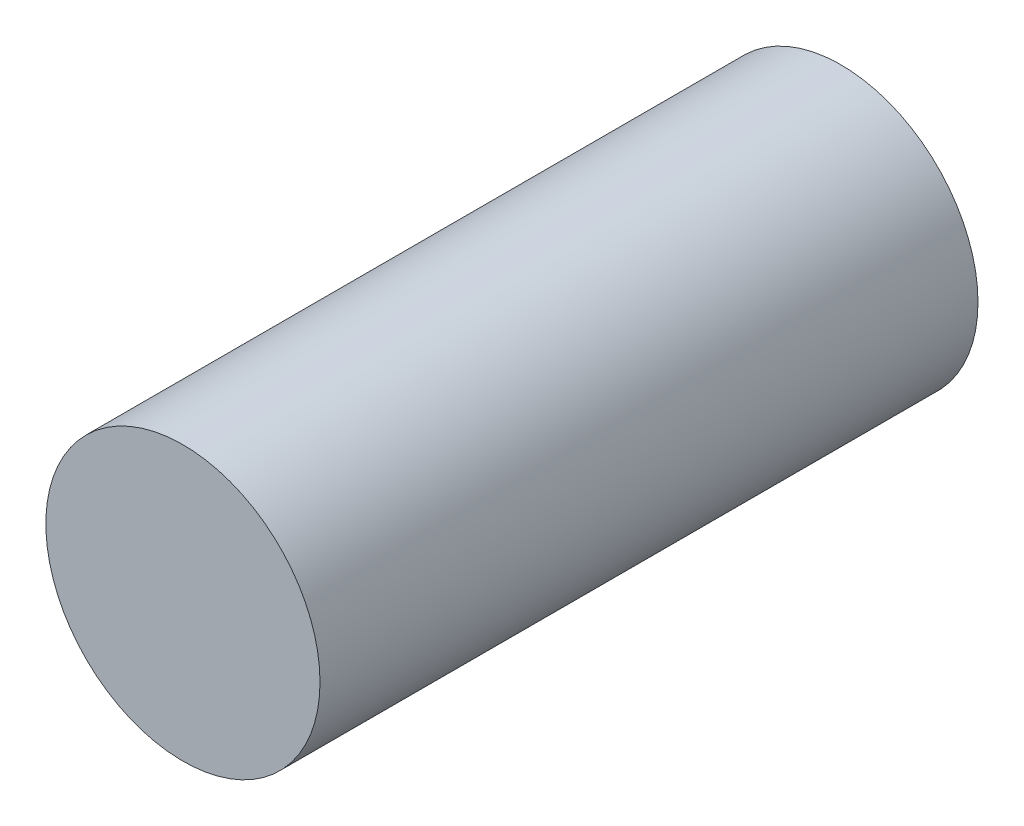
from build123d import *

# Parameters (mm, degrees)
SKETCH_1_R      = 5
EXTRUDE_1_DEPTH = 24


with BuildPart() as part:
    # 草图1 → 凸台-拉伸1 (new body)
    with BuildSketch(Plane.XY):
        Circle(SKETCH_1_R)
    extrude(amount=EXTRUDE_1_DEPTH)


solid = part.part
